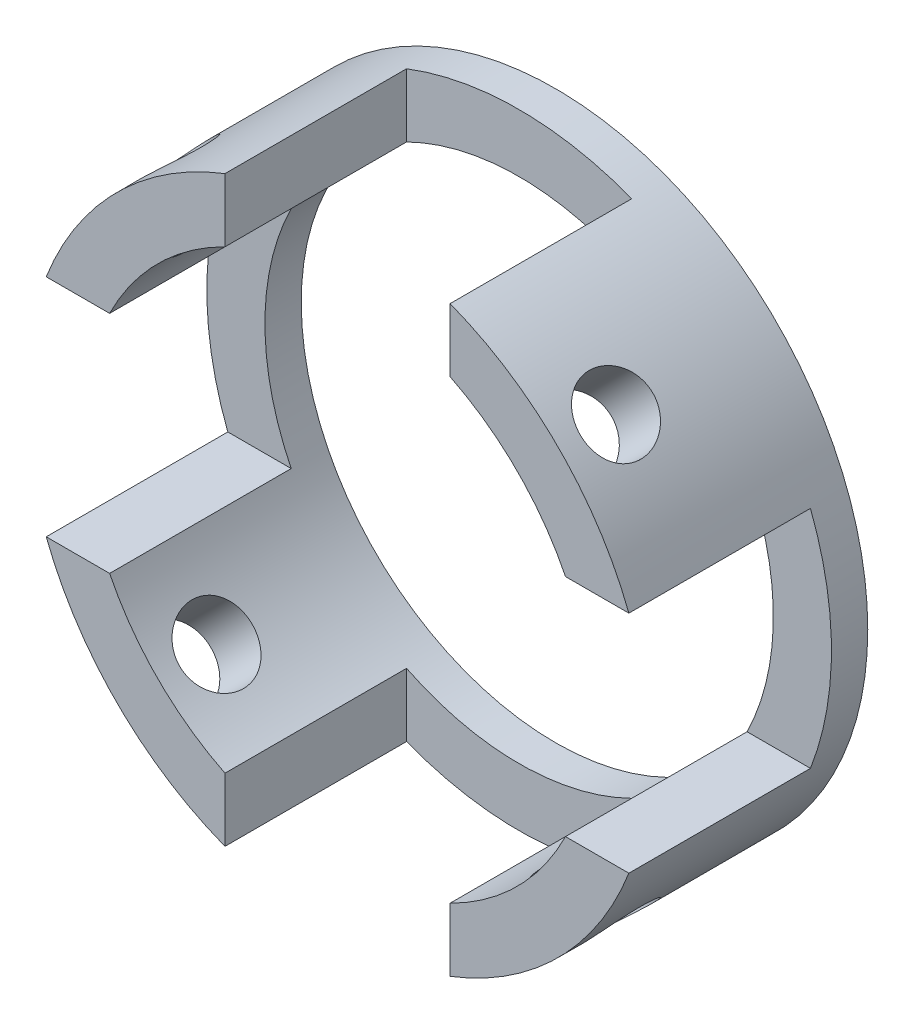
from build123d import *
from build123d.topology import SkipClean

# Parameters (mm, degrees)
SKETCH1_R           = 4.3
SKETCH1_R_2         = 3.5
BOSS_EXTRUDE1_DEPTH = 0.5
BOSS_EXTRUDE2_DEPTH = 2.5
SKETCH5_R           = 0.5
CUT_EXTRUDE2_DEPTH  = 3
CIRPATTERN1_COUNT   = 4


with BuildPart() as part:
    # Sketch1 → Boss-Extrude1 (new body)
    with BuildSketch(Plane.XY):
        Circle(SKETCH1_R)
        Circle(SKETCH1_R_2, mode=Mode.SUBTRACT)
    extrude(amount=BOSS_EXTRUDE1_DEPTH)

    # Sketch2 → Boss-Extrude2 (add)
    with SkipClean():  # the faces are left unmerged after this step: merging them gives an invalid solid
        with BuildSketch(Plane.XY.offset(0.5)):
            with BuildLine():
                Line((4.010922587, 1.55), (3.138072657, 1.55))
                ThreePointArc((3.138072657, 1.55), (2.474873734, 2.474873734), (1.55, 3.138072657))
                Line((1.55, 3.138072657), (1.55, 4.010922587))
                ThreePointArc((1.55, 4.010922587), (3.040559159, 3.040559159), (4.010922587, 1.55))
            make_face()
            with BuildLine():
                Line((-4.010922587, 1.55), (-3.138072657, 1.55))
                ThreePointArc((-3.138072657, 1.55), (-2.474873734, 2.474873734), (-1.55, 3.138072657))
                Line((-1.55, 3.138072657), (-1.55, 4.010922587))
                ThreePointArc((-1.55, 4.010922587), (-3.040559159, 3.040559159), (-4.010922587, 1.55))
            make_face()
            with BuildLine():
                Line((1.55, -4.010922587), (1.55, -3.138072657))
                ThreePointArc((1.55, -3.138072657), (2.474873734, -2.474873734), (3.138072657, -1.55))
                Line((3.138072657, -1.55), (4.010922587, -1.55))
                ThreePointArc((4.010922587, -1.55), (3.040559159, -3.040559159), (1.55, -4.010922587))
            make_face()
            with BuildLine():
                Line((-4.010922587, -1.55), (-3.138072657, -1.55))
                ThreePointArc((-3.138072657, -1.55), (-2.474873734, -2.474873734), (-1.55, -3.138072657))
                Line((-1.55, -3.138072657), (-1.55, -4.010922587))
                ThreePointArc((-1.55, -4.010922587), (-3.040559159, -3.040559159), (-4.010922587, -1.55))
            make_face()
        extrude(amount=BOSS_EXTRUDE2_DEPTH)

    # Sketch5 → Cut-Extrude2 (cut)
    with SkipClean():  # the faces are left unmerged after this step: merging them gives an invalid solid
        with BuildSketch(Plane(origin=(3.040559159, 3.040559159, 0), x_dir=(0, 0, -1), z_dir=(0.7071067811865499, 0.7071067811865452, 0))):
            with Locations(Location((-2.2, 0, 0), (0, 0, 90))):
                Circle(SKETCH5_R)
        cut_extrude2 = extrude(amount=-CUT_EXTRUDE2_DEPTH, mode=Mode.SUBTRACT)

    # CirPattern1: Cut-Extrude2 ×4 about axis
    with SkipClean():  # the faces are left unmerged after this step: merging them gives an invalid solid
        cirpattern1_axis = Axis((0, 0, 0.5), (0, 0, -1))
        for i in range(1, CIRPATTERN1_COUNT):
            add(cut_extrude2.rotate(cirpattern1_axis, i * 360 / CIRPATTERN1_COUNT), mode=Mode.SUBTRACT)


solid = part.part
